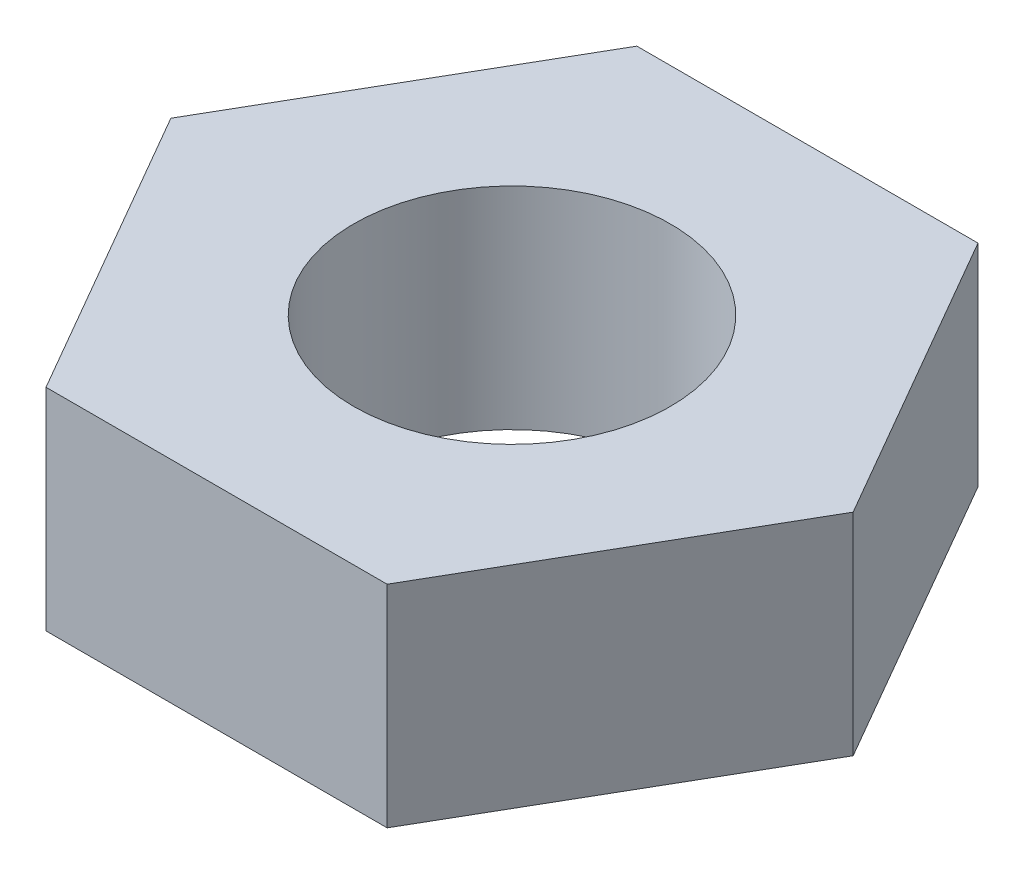
from build123d import *

# Parameters (mm, degrees)
SKETCH1_R           = 1.905
BOSS_EXTRUDE1_DEPTH = 2.54


with BuildPart() as part:
    # Sketch1 → Boss-Extrude1 (new body)
    with BuildSketch(Plane(origin=(0, 0, 0), x_dir=(1, 0, 0), z_dir=(0, 1, 0))):
        Polygon((2.053057557, 3.556), (-2.053057557, 3.556), (-4.106115114, 0), (-2.053057557, -3.556), (2.053057557, -3.556), (4.106115114, 0), align=None)
        with Locations(Location((0, 0, 0), (0, 0, 270))):
            Circle(SKETCH1_R, mode=Mode.SUBTRACT)
    extrude(amount=-BOSS_EXTRUDE1_DEPTH)


solid = part.part
